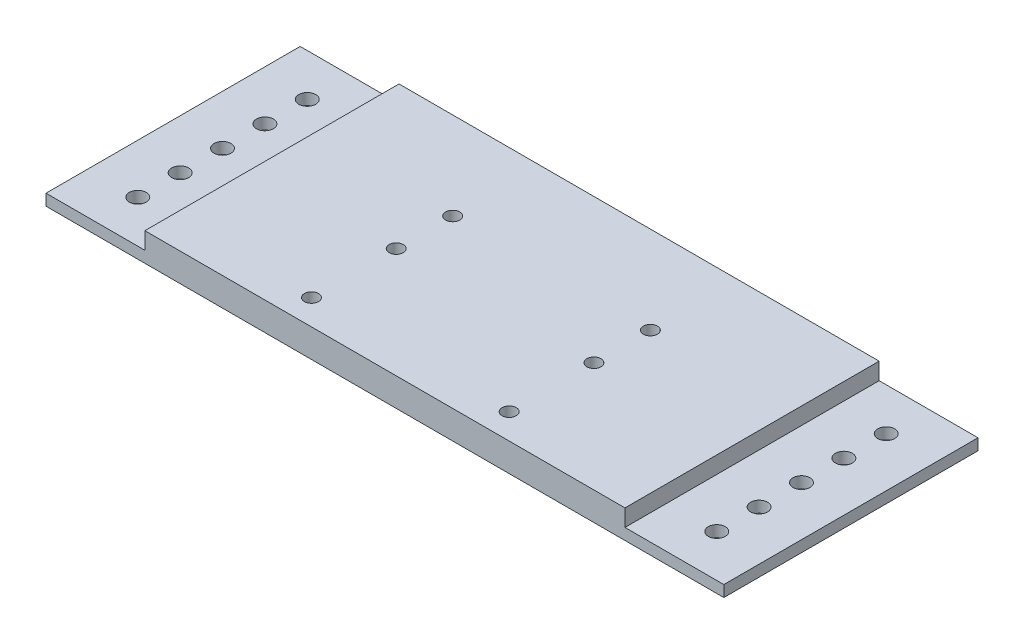
from build123d import *

# Parameters (mm, degrees)
SKETCH_1_W          = 240
SKETCH_1_H          = 90
EXTRUDE_1_DEPTH     = 4
SKETCH_2_W          = 170
SKETCH_2_H          = 90
EXTRUDE_2_DEPTH     = 6
SKETCH_3_R          = 3
CUT_EXTRUDE_1_DEPTH = 257.390327431
SKETCH_4_R          = 2.5
CUT_EXTRUDE_5_DEPTH = 257.515106768


with BuildPart() as part:
    # 草图1 → 凸台-拉伸1 (new body)
    with BuildSketch(Plane(origin=(0, 0, 0), x_dir=(1, 0, 0), z_dir=(0, 1, 0))):
        with Locations((120, -45)):
            Rectangle(SKETCH_1_W, SKETCH_1_H)
    extrude(amount=EXTRUDE_1_DEPTH)

    # 草图2 → 凸台-拉伸2 (add)
    with BuildSketch(Plane(origin=(0, 4, 0), x_dir=(1, 0, 0), z_dir=(0, 1, 0))):
        with Locations((120, -45)):
            Rectangle(SKETCH_2_W, SKETCH_2_H)
    extrude(amount=EXTRUDE_2_DEPTH)

    # 草图3 → 切除-拉伸1 (cut, through all)
    with BuildSketch(Plane(origin=(0, 4, 0), x_dir=(1, 0, 0), z_dir=(0, 1, 0))):
        with Locations(Location((17.5, -15, 0), (0, 0, 270))):
            Circle(SKETCH_3_R)
        with Locations(Location((17.5, -30, 0), (0, 0, 270))):
            Circle(SKETCH_3_R)
        with Locations(Location((17.5, -45, 0), (0, 0, 270))):
            Circle(SKETCH_3_R)
        with Locations(Location((17.5, -60, 0), (0, 0, 270))):
            Circle(SKETCH_3_R)
        with Locations(Location((17.5, -75, 0), (0, 0, 270))):
            Circle(SKETCH_3_R)
        with Locations(Location((222.5, -75, 0), (0, 0, 90))):
            Circle(SKETCH_3_R)
        with Locations(Location((222.5, -60, 0), (0, 0, 90))):
            Circle(SKETCH_3_R)
        with Locations(Location((222.5, -45, 0), (0, 0, 90))):
            Circle(SKETCH_3_R)
        with Locations(Location((222.5, -30, 0), (0, 0, 90))):
            Circle(SKETCH_3_R)
        with Locations(Location((222.5, -15, 0), (0, 0, 90))):
            Circle(SKETCH_3_R)
    extrude(amount=-CUT_EXTRUDE_1_DEPTH, mode=Mode.SUBTRACT)

    # 草图4 → 切除-拉伸5 (cut, through all)
    with BuildSketch(Plane.XZ):
        with Locations(Location((85, 81, 0), (0, 0, 270))):
            Circle(SKETCH_4_R)
        with Locations(Location((155, 81, 0), (0, 0, 270))):
            Circle(SKETCH_4_R)
        with Locations(Location((85, 31, 0), (0, 0, 270))):
            Circle(SKETCH_4_R)
        with Locations(Location((155, 31, 0), (0, 0, 270))):
            Circle(SKETCH_4_R)
        with Locations(Location((85, 51, 0), (0, 0, 270))):
            Circle(SKETCH_4_R)
        with Locations(Location((155, 51, 0), (0, 0, 270))):
            Circle(SKETCH_4_R)
    extrude(amount=-CUT_EXTRUDE_5_DEPTH, mode=Mode.SUBTRACT)


solid = part.part
